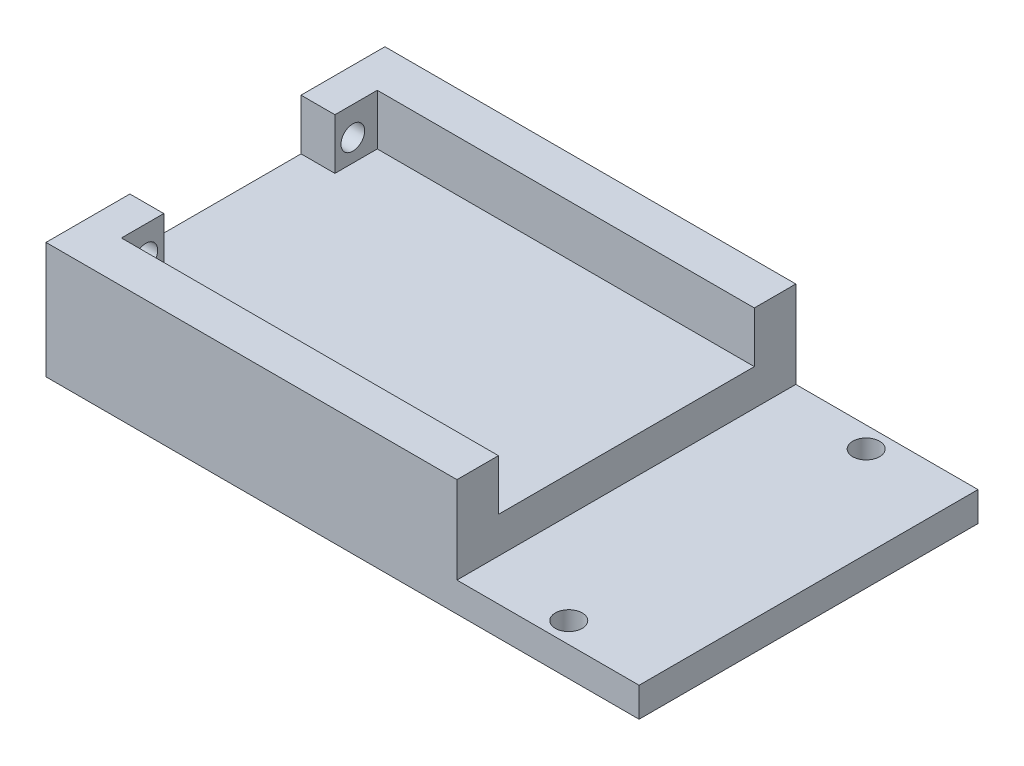
from build123d import *

# Parameters (mm, degrees)
BOSS_EXTRUDE1_DEPTH = 80
BOSS_EXTRUDE2_DEPTH = 12
SKETCH3_R           = 2.795
CUT_EXTRUDE1_DEPTH  = 60
SKETCH4_R           = 3.175
CUT_EXTRUDE2_DEPTH  = 10


with BuildPart() as part:
    # Sketch1 → Boss-Extrude1 (new body)
    with BuildSketch(Plane.XY):
        Polygon((140, 0), (0, 0), (0, 15.49), (97, 15.49), (97, 6.96), (140, 6.96), align=None)
    extrude(amount=BOSS_EXTRUDE1_DEPTH)

    # Sketch2 → Boss-Extrude2 (add)
    with BuildSketch(Plane(origin=(0, 15.49, 0), x_dir=(1, 0, 0), z_dir=(0, 1, 0))):
        Polygon((97, 0), (0, 0), (0, -9.8), (0, -19.8), (8, -19.8), (8, -9.8), (97, -9.8), align=None)
        Polygon((8, -60.2), (0, -60.2), (0, -70.2), (0, -80), (97, -80), (97, -70.2), (8, -70.2), align=None)
    extrude(amount=BOSS_EXTRUDE2_DEPTH)

    # Sketch3 → Cut-Extrude1 (cut)
    with BuildSketch(Plane.ZY):
        with Locations((15.57, 20.72)):
            Circle(SKETCH3_R)
        with Locations((64.43, 20.72)):
            Circle(SKETCH3_R)
    extrude(amount=-CUT_EXTRUDE1_DEPTH, mode=Mode.SUBTRACT)

    # Sketch4 → Cut-Extrude2 (cut)
    with BuildSketch(Plane(origin=(0, 6.96, 0), x_dir=(1, 0, 0), z_dir=(0, 1, 0))):
        with Locations(Location((118.5, -4.9, 0), (0, 0, 270))):
            Circle(SKETCH4_R)
        with Locations(Location((118.5, -75.1, 0), (0, 0, 270))):
            Circle(SKETCH4_R)
    extrude(amount=-CUT_EXTRUDE2_DEPTH, mode=Mode.SUBTRACT)


solid = part.part
